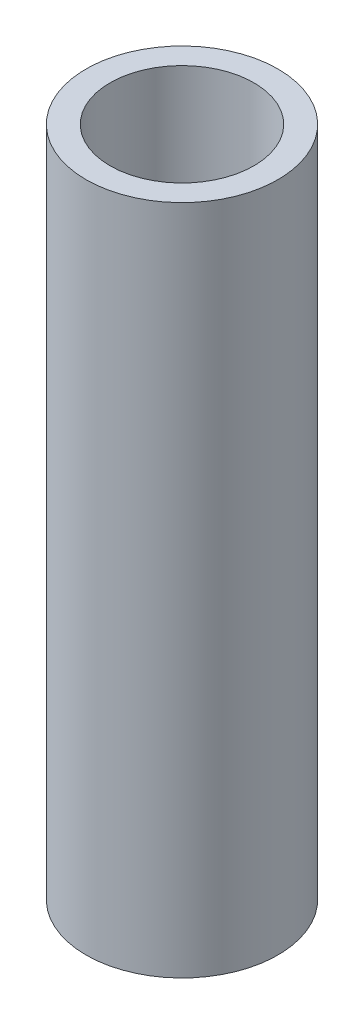
from build123d import *

# Parameters (mm, degrees)
SKETCH2_R           = 12.7
SKETCH2_R_2         = 9.525
BOSS_EXTRUDE1_DEPTH = 88.9


with BuildPart() as part:
    # Sketch2 → Boss-Extrude1 (new body)
    with BuildSketch(Plane(origin=(0, 0, 0), x_dir=(1, 0, 0), z_dir=(0, 1, 0))):
        with Locations(Location((-14.567556118, 0, 0), (0, 0, 270))):
            Circle(SKETCH2_R)
        with Locations(Location((-14.567556118, 0, 0), (0, 0, 270))):
            Circle(SKETCH2_R_2, mode=Mode.SUBTRACT)
    extrude(amount=BOSS_EXTRUDE1_DEPTH)


solid = part.part
